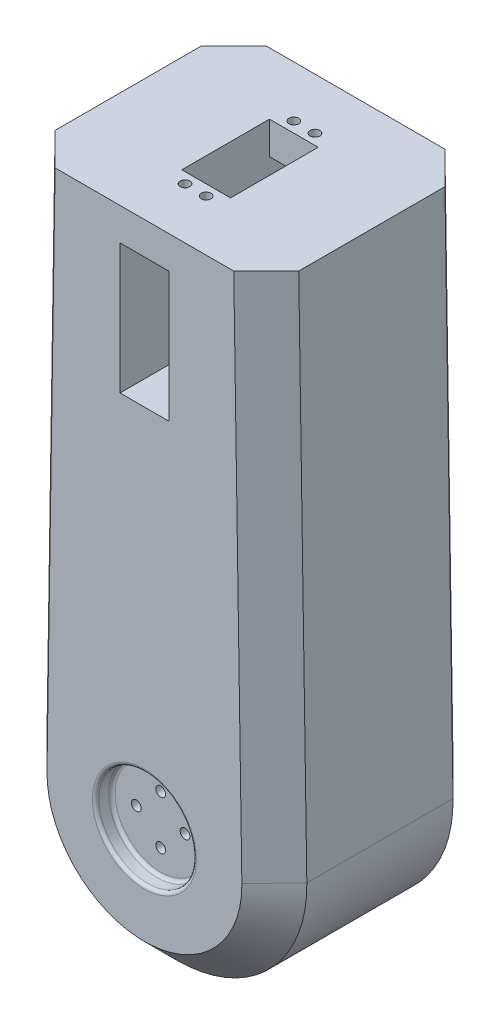
from build123d import *

# Parameters (mm, degrees)
BOSS_EXTRUDE1_DEPTH = 65
CHAMFER1_SIZE       = 10
SKETCH2_R           = 15
CUT_EXTRUDE1_DEPTH  = 5
SKETCH3_R           = 1.5
CUT_EXTRUDE2_DEPTH  = 7.5
FILLET1_R           = 1
SKETCH4_W           = 15
SKETCH4_H           = 40
CUT_EXTRUDE3_DEPTH  = 180.530638054
SKETCH5_R           = 1.5
SKETCH5_W           = 15
SKETCH5_H           = 27
CUT_EXTRUDE4_DEPTH  = 10


with BuildPart() as part:
    # Sketch1 → Boss-Extrude1 (new body)
    with BuildSketch(Plane.XY):
        with BuildLine():
            Line((-37.5, 162.5), (37.5, 162.5))
            Line((37.5, 162.5), (39.995249108, 0.616480975))
            ThreePointArc((39.995249108, 0.616480975), (0, -40), (-39.995249108, 0.616480975))
            Line((-39.995249108, 0.616480975), (-37.5, 162.5))
        make_face()
    extrude(amount=BOSS_EXTRUDE1_DEPTH)

    # Chamfer1
    chamfer1_edges = [part.edges().sort_by_distance(p)[0] for p in [
        (-38.747624554, 81.558240488, 65),
        (0, -40, 65),
        (38.747624554, 81.558240488, 65),
        (0, -40, 0),
        (-38.747624554, 81.558240488, 0),
        (38.747624554, 81.558240488, 0),
    ]]
    chamfer(chamfer1_edges, length=CHAMFER1_SIZE)

    # Sketch2 → Cut-Extrude1 (cut)
    with BuildSketch(Plane.XY.offset(65)):
        Circle(SKETCH2_R)
    extrude(amount=-CUT_EXTRUDE1_DEPTH, mode=Mode.SUBTRACT)

    # Sketch3 → Cut-Extrude2 (cut)
    with BuildSketch(Plane.XY.offset(60)):
        with Locations((0, 7.5)):
            Circle(SKETCH3_R)
        with Locations((7.5, 0)):
            Circle(SKETCH3_R)
        with Locations((0, -7.5)):
            Circle(SKETCH3_R)
        with Locations((-7.5, 0)):
            Circle(SKETCH3_R)
    extrude(amount=-CUT_EXTRUDE2_DEPTH, mode=Mode.SUBTRACT)

    # Fillet1
    fillet1_edges = [part.edges().sort_by_distance(p)[0] for p in [
        (-15, 0, 60),
        (-15, 0, 65),
    ]]
    fillet(fillet1_edges, radius=FILLET1_R)

    # Sketch4 → Cut-Extrude3 (cut, through all)
    with BuildSketch(Plane.XY.offset(65)):
        with Locations((0, 132.5)):
            Rectangle(SKETCH4_W, SKETCH4_H)
    extrude(amount=-CUT_EXTRUDE3_DEPTH, mode=Mode.SUBTRACT)

    # Sketch5 → Cut-Extrude4 (cut)
    with BuildSketch(Plane(origin=(0, 162.5, 0), x_dir=(1, 0, 0), z_dir=(0, 1, 0))):
        with Locations(Location((-3.25, -15.75, 0), (0, 0, 270))):
            Circle(SKETCH5_R)
        with Locations(Location((3.25, -15.75, 0), (0, 0, 270))):
            Circle(SKETCH5_R)
        with Locations(Location((3.25, -49.25, 0), (0, 0, 270))):
            Circle(SKETCH5_R)
        with Locations(Location((-3.25, -49.25, 0), (0, 0, 270))):
            Circle(SKETCH5_R)
        with Locations((0, -32.5)):
            Rectangle(SKETCH5_W, SKETCH5_H)
    extrude(amount=-CUT_EXTRUDE4_DEPTH, mode=Mode.SUBTRACT)


solid = part.part
